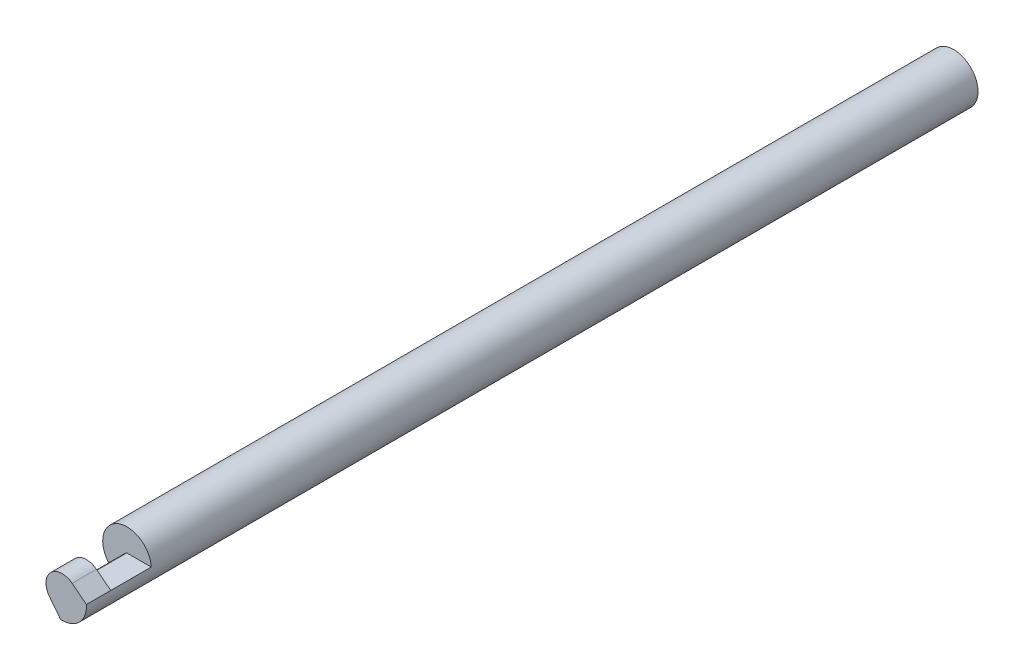
from build123d import *

# Parameters (mm, degrees)
SKETCH1_W          = 55
SKETCH1_H          = 1.5
CUT_EXTRUDE1_START = -4
CUT_EXTRUDE1_DEPTH = 2.5
CUT_EXTRUDE2_START = -1.5
CUT_EXTRUDE2_DEPTH = 1.5


with BuildPart() as part:
    # Sketch1 → Revolve1 (revolve)
    with BuildSketch(Plane(origin=(0, 0, 0), x_dir=(0, 0, -1), z_dir=(1, 0, 0)), mode=Mode.PRIVATE) as revolve1_sk:
        with Locations((27.5, 0.75)):
            Rectangle(SKETCH1_W, SKETCH1_H)
    revolve(revolve1_sk.sketch.rotate(Axis((0, 0, 9.840994653), (0, 0, -1)), 180), axis=Axis((0, 0, 9.840994653), (0, 0, -1)))

    # Sketch2 → Cut-Extrude1 (cut)
    with BuildSketch(Plane.XY.offset(CUT_EXTRUDE1_START)):
        with BuildLine():
            Line((0, 0.1), (1.496662955, 0.1))
            ThreePointArc((1.496662955, 0.1), (-1.060660172, 1.060660172), (-0.1, -1.496662955))
            Line((-0.1, -1.496662955), (-0.1, 0))
            ThreePointArc((-0.1, 0), (-0.070710678, 0.070710678), (0, 0.1))
        make_face()
    extrude(amount=CUT_EXTRUDE1_DEPTH, mode=Mode.SUBTRACT)

    # Sketch3 → Cut-Extrude2 (cut)
    with BuildSketch(Plane.XY.offset(CUT_EXTRUDE2_START)):
        with BuildLine():
            Line((1.496662955, 0.1), (0.615493136, 0.788142246))
            ThreePointArc((0.615493136, 0.788142246), (-0.707106781, 0.707106781), (-0.788142246, -0.615493136))
            Line((-0.788142246, -0.615493136), (-0.1, -1.496662955))
            ThreePointArc((-0.1, -1.496662955), (-1.060660172, 1.060660172), (1.496662955, 0.1))
        make_face()
    extrude(amount=CUT_EXTRUDE2_DEPTH, mode=Mode.SUBTRACT)


solid = part.part
